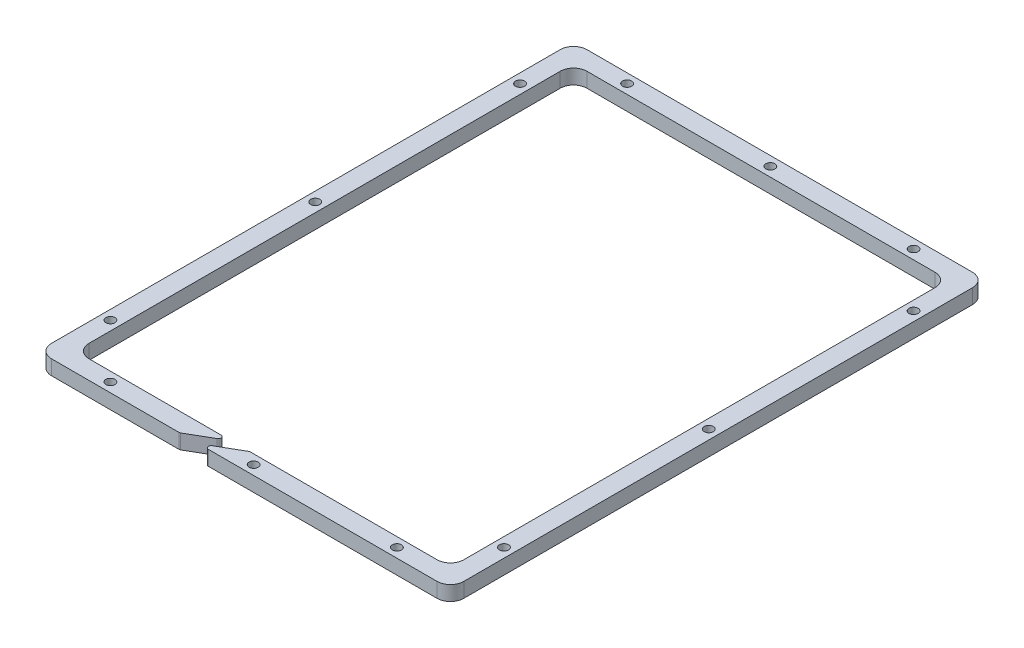
from build123d import *

# Parameters (mm, degrees)
SKETCH1_W           = 154
SKETCH1_H           = 200
SKETCH1_W_2         = 140
SKETCH1_H_2         = 186
BOSS_EXTRUDE1_DEPTH = 5.5
FILLET1_R           = 5
SKETCH3_R           = 1.7
CUT_EXTRUDE1_DEPTH  = 127.329925196
CUT_EXTRUDE2_DEPTH  = 127.329925196
FILLET2_R           = 1


with BuildPart() as part:
    # Sketch1 → Boss-Extrude1 (new body)
    with BuildSketch(Plane(origin=(0, 0, 0), x_dir=(1, 0, 0), z_dir=(0, 1, 0))):
        Rectangle(SKETCH1_W, SKETCH1_H)
        Rectangle(SKETCH1_W_2, SKETCH1_H_2, mode=Mode.SUBTRACT)
    extrude(amount=BOSS_EXTRUDE1_DEPTH)

    # Fillet1
    fillet1_edges = [part.edges().sort_by_distance(p)[0] for p in [
        (70, 2.75, 93),
        (70, 2.75, -93),
        (-70, 2.75, -93),
        (-70, 2.75, 93),
        (-77, 2.75, -100),
        (77, 2.75, -100),
        (77, 2.75, 100),
        (-77, 2.75, 100),
    ]]
    fillet(fillet1_edges, radius=FILLET1_R)

    # Sketch3 → Cut-Extrude1 (cut, through all)
    with BuildSketch(Plane.XZ):
        with Locations(Location((73.5, -76.5, 0), (0, 0, 270))):
            Circle(SKETCH3_R)
        with Locations(Location((53.5, -96.5, 0), (0, 0, 270))):
            Circle(SKETCH3_R)
        with Locations(Location((-53.5, -96.5, 0), (0, 0, 270))):
            Circle(SKETCH3_R)
        with Locations(Location((-73.5, -76.5, 0), (0, 0, 270))):
            Circle(SKETCH3_R)
        with Locations(Location((-73.5, 0, 0), (0, 0, 270))):
            Circle(SKETCH3_R)
        with Locations(Location((-73.5, 76.5, 0), (0, 0, 270))):
            Circle(SKETCH3_R)
        with Locations(Location((-53.5, 96.5, 0), (0, 0, 270))):
            Circle(SKETCH3_R)
        with Locations(Location((53.5, 96.5, 0), (0, 0, 270))):
            Circle(SKETCH3_R)
        with Locations(Location((73.5, 76.5, 0), (0, 0, 270))):
            Circle(SKETCH3_R)
        with Locations(Location((73.5, 0, 0), (0, 0, 270))):
            Circle(SKETCH3_R)
        with Locations(Location((0, -96.5, 0), (0, 0, 270))):
            Circle(SKETCH3_R)
        with Locations(Location((0, 96.5, 0), (0, 0, 270))):
            Circle(SKETCH3_R)
    extrude(amount=-CUT_EXTRUDE1_DEPTH, mode=Mode.SUBTRACT)

    # Sketch4 → Cut-Extrude2 (cut, through all)
    with BuildSketch(Plane(origin=(0, 5.5, 0), x_dir=(1, 0, 0), z_dir=(0, 1, 0))):
        Polygon((-17.124355653, -100), (-5, -93), (-12, -93), (-24.124355653, -100), align=None)
    extrude(amount=-CUT_EXTRUDE2_DEPTH, mode=Mode.SUBTRACT)

    # Fillet2
    fillet2_edges = [part.edges().sort_by_distance(p)[0] for p in [
        (-17.124355653, 2.75, 100),
        (-24.124355653, 2.75, 100),
        (-12, 2.75, 93),
        (-5, 2.75, 93),
    ]]
    fillet(fillet2_edges, radius=FILLET2_R)


solid = part.part
